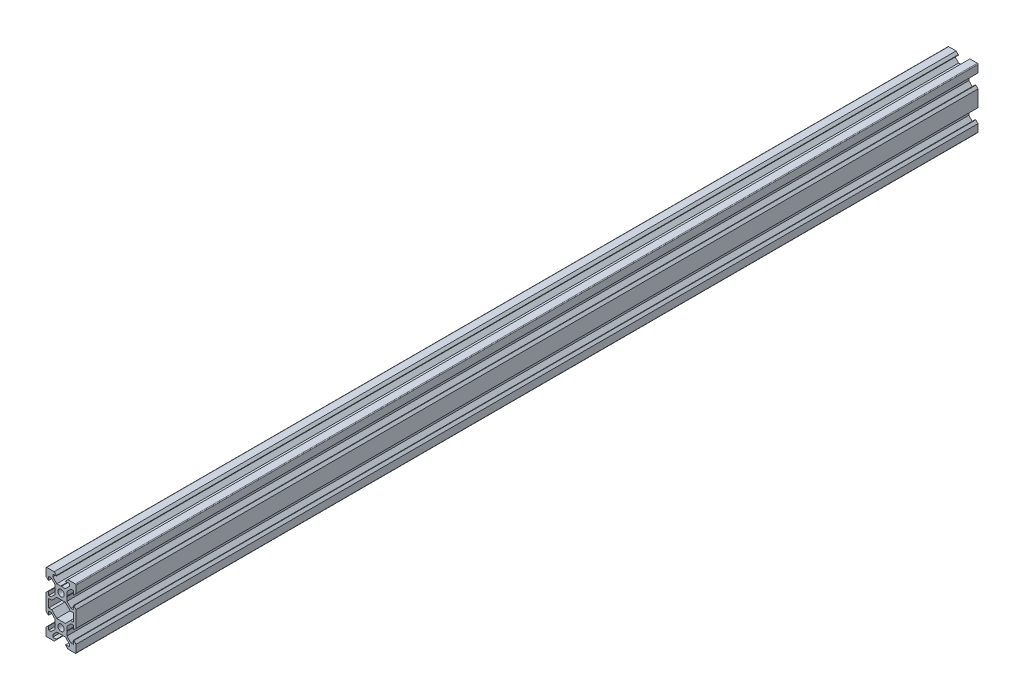
from build123d import *

# Parameters (mm, degrees)
SKETCH1_R           = 2.1
BOSS_EXTRUDE1_DEPTH = 600


with BuildPart() as part:
    # Sketch1 → Boss-Extrude1 (new body)
    with BuildSketch(Plane.XY):
        with BuildLine():
            Line((4.58, -20), (9.5, -20))
            ThreePointArc((9.5, -20), (9.853553391, -19.853553391), (10, -19.5))
            Line((10, -19.5), (10, -14.58))
            Line((10, -14.58), (8.545, -13.125))
            Line((8.545, -13.125), (8.2, -13.125))
            Line((8.2, -13.125), (8.2, -15.5))
            Line((8.2, -15.5), (6.560660172, -15.5))
            Line((6.560660172, -15.5), (3.9, -12.839339828))
            Line((3.9, -12.839339828), (3.9, -10.21))
            Line((3.9, -10.21), (3.69, -10))
            Line((3.69, -10), (3.9, -9.79))
            Line((3.9, -9.79), (3.9, -7.160660172))
            Line((3.9, -7.160660172), (6.560660172, -4.5))
            Line((6.560660172, -4.5), (8.2, -4.5))
            Line((8.2, -4.5), (8.2, -6.875))
            Line((8.2, -6.875), (8.545, -6.875))
            Line((8.545, -6.875), (10, -5.42))
            Line((10, -5.42), (10, 5.42))
            Line((10, 5.42), (8.545, 6.875))
            Line((8.545, 6.875), (8.2, 6.875))
            Line((8.2, 6.875), (8.2, 4.5))
            Line((8.2, 4.5), (6.560660172, 4.5))
            Line((6.560660172, 4.5), (3.9, 7.160660172))
            Line((3.9, 7.160660172), (3.9, 9.79))
            Line((3.9, 9.79), (3.69, 10))
            Line((3.69, 10), (3.9, 10.21))
            Line((3.9, 10.21), (3.9, 12.839339828))
            Line((3.9, 12.839339828), (6.560660172, 15.5))
            Line((6.560660172, 15.5), (8.2, 15.5))
            Line((8.2, 15.5), (8.2, 13.125))
            Line((8.2, 13.125), (8.545, 13.125))
            Line((8.545, 13.125), (10, 14.58))
            Line((10, 14.58), (10, 19.5))
            ThreePointArc((10, 19.5), (9.853553391, 19.853553391), (9.5, 20))
            Line((9.5, 20), (4.58, 20))
            Line((4.58, 20), (3.125, 18.545))
            Line((3.125, 18.545), (3.125, 18.2))
            Line((3.125, 18.2), (5.5, 18.2))
            Line((5.5, 18.2), (5.5, 16.560660172))
            Line((5.5, 16.560660172), (2.839339828, 13.9))
            Line((2.839339828, 13.9), (0.21, 13.9))
            Line((0.21, 13.9), (0, 13.69))
            Line((0, 13.69), (-0.21, 13.9))
            Line((-0.21, 13.9), (-2.839339828, 13.9))
            Line((-2.839339828, 13.9), (-5.5, 16.560660172))
            Line((-5.5, 16.560660172), (-5.5, 18.2))
            Line((-5.5, 18.2), (-3.125, 18.2))
            Line((-3.125, 18.2), (-3.125, 18.545))
            Line((-3.125, 18.545), (-4.58, 20))
            Line((-4.58, 20), (-9.5, 20))
            ThreePointArc((-9.5, 20), (-9.853553391, 19.853553391), (-10, 19.5))
            Line((-10, 19.5), (-10, 14.58))
            Line((-10, 14.58), (-8.545, 13.125))
            Line((-8.545, 13.125), (-8.2, 13.125))
            Line((-8.2, 13.125), (-8.2, 15.5))
            Line((-8.2, 15.5), (-6.560660172, 15.5))
            Line((-6.560660172, 15.5), (-3.9, 12.839339828))
            Line((-3.9, 12.839339828), (-3.9, 10.21))
            Line((-3.9, 10.21), (-3.69, 10))
            Line((-3.69, 10), (-3.9, 9.79))
            Line((-3.9, 9.79), (-3.9, 7.160660172))
            Line((-3.9, 7.160660172), (-6.560660172, 4.5))
            Line((-6.560660172, 4.5), (-8.2, 4.5))
            Line((-8.2, 4.5), (-8.2, 6.875))
            Line((-8.2, 6.875), (-8.545, 6.875))
            Line((-8.545, 6.875), (-10, 5.42))
            Line((-10, 5.42), (-10, -5.42))
            Line((-10, -5.42), (-8.545, -6.875))
            Line((-8.545, -6.875), (-8.2, -6.875))
            Line((-8.2, -6.875), (-8.2, -4.5))
            Line((-8.2, -4.5), (-6.560660172, -4.5))
            Line((-6.560660172, -4.5), (-3.9, -7.160660172))
            Line((-3.9, -7.160660172), (-3.9, -9.79))
            Line((-3.9, -9.79), (-3.69, -10))
            Line((-3.69, -10), (-3.9, -10.21))
            Line((-3.9, -10.21), (-3.9, -12.839339828))
            Line((-3.9, -12.839339828), (-6.560660172, -15.5))
            Line((-6.560660172, -15.5), (-8.2, -15.5))
            Line((-8.2, -15.5), (-8.2, -13.125))
            Line((-8.2, -13.125), (-8.545, -13.125))
            Line((-8.545, -13.125), (-10, -14.58))
            Line((-10, -14.58), (-10, -19.5))
            ThreePointArc((-10, -19.5), (-9.853553391, -19.853553391), (-9.5, -20))
            Line((-9.5, -20), (-4.58, -20))
            Line((-4.58, -20), (-3.125, -18.545))
            Line((-3.125, -18.545), (-3.125, -18.2))
            Line((-3.125, -18.2), (-5.5, -18.2))
            Line((-5.5, -18.2), (-5.5, -16.560660172))
            Line((-5.5, -16.560660172), (-2.839339828, -13.9))
            Line((-2.839339828, -13.9), (-0.21, -13.9))
            Line((-0.21, -13.9), (0, -13.69))
            Line((0, -13.69), (0.21, -13.9))
            Line((0.21, -13.9), (2.839339828, -13.9))
            Line((2.839339828, -13.9), (5.5, -16.560660172))
            Line((5.5, -16.560660172), (5.5, -18.2))
            Line((5.5, -18.2), (3.125, -18.2))
            Line((3.125, -18.2), (3.125, -18.545))
            Line((3.125, -18.545), (4.58, -20))
        make_face()
        with Locations((0, -10)):
            Circle(SKETCH1_R, mode=Mode.SUBTRACT)
        Polygon((-6.239339828, -2.7), (-8.2, -2.7), (-8.2, 2.7), (-6.239339828, 2.7), (-2.839339828, 6.1), (2.839339828, 6.1), (6.239339828, 2.7), (8.2, 2.7), (8.2, -2.7), (6.239339828, -2.7), (2.839339828, -6.1), (-2.839339828, -6.1), align=None, mode=Mode.SUBTRACT)
        with Locations((0, 10)):
            Circle(SKETCH1_R, mode=Mode.SUBTRACT)
    extrude(amount=BOSS_EXTRUDE1_DEPTH)


solid = part.part
